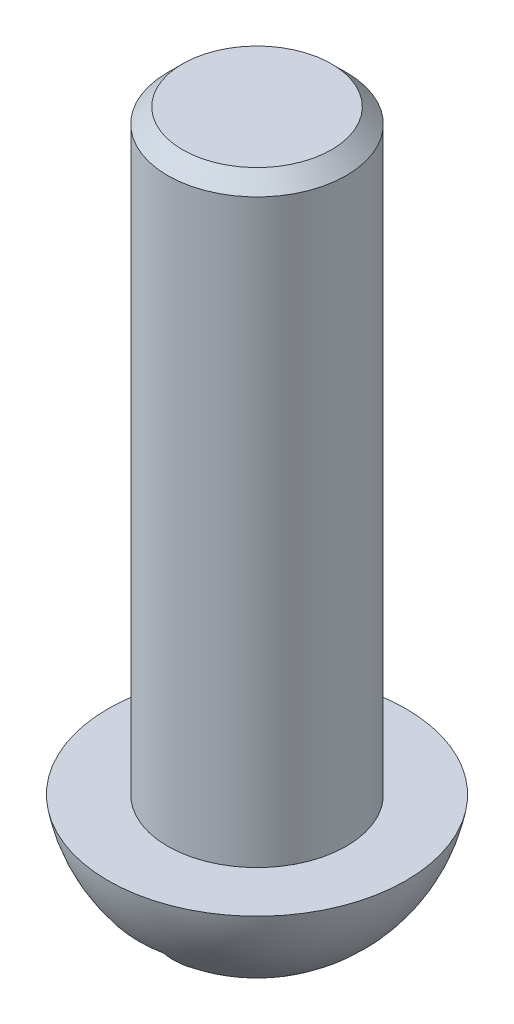
from build123d import *

# Parameters (mm, degrees)
SKETCH1_R               = 3
BOSS_EXTRUDE1_DEPTH     = 20
CHAMFER1_SIZE           = 0.5
CUT_EXTRUDE1_DEPTH      = 22.213203483
CUT_EXTRUDE1_DEPTH_BACK = 22.213203483


with BuildPart() as part:
    # Sketch1 → Boss-Extrude1 (new body)
    with BuildSketch(Plane(origin=(0, 0, 0), x_dir=(1, 0, 0), z_dir=(0, 1, 0))):
        with Locations(Location((0, 0, 0), (0, 0, 270))):
            Circle(SKETCH1_R)
    extrude(amount=BOSS_EXTRUDE1_DEPTH)

    # Chamfer1
    chamfer1_edges = [part.edges().sort_by_distance(p)[0] for p in [
        (0, 20, -3),
    ]]
    chamfer(chamfer1_edges, length=CHAMFER1_SIZE)

    # Sketch2 → Revolve1 (revolve)
    with BuildSketch(Plane.XY, mode=Mode.PRIVATE) as revolve1_sk:
        with BuildLine():
            Line((0, 0), (-5, 0))
            ThreePointArc((-5, 0), (-3.260312474, -3.005133898), (0, -4.2))
            Line((0, -4.2), (0, 0))
        make_face()
    revolve(revolve1_sk.sketch.rotate(Axis((0, -4.2, 0), (0, 1, 0)), 270), axis=Axis((0, -4.2, 0), (0, 1, 0)))

    # Sketch3 → Cut-Extrude1 (cut, two sides: drawn at the far end of the back side and taken through both)
    with BuildSketch(Plane.XY.offset(-CUT_EXTRUDE1_DEPTH_BACK)):
        Polygon((-0.76031497, -2.29), (0, -2.29), (0.76031497, -2.29), (0.76031497, -6.2280618), (-0.76031497, -6.2280618), align=None)
    extrude(amount=CUT_EXTRUDE1_DEPTH + CUT_EXTRUDE1_DEPTH_BACK, mode=Mode.SUBTRACT)


solid = part.part
